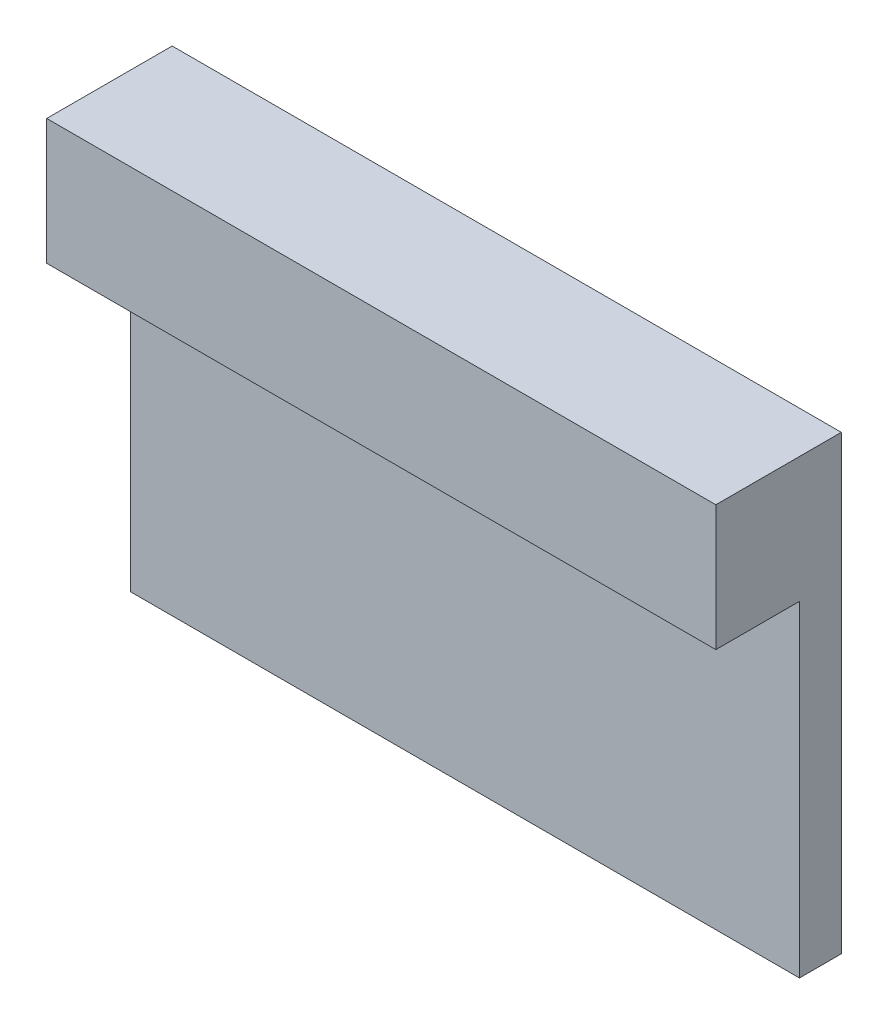
from build123d import *

# Parameters (mm, degrees)
SKETCH2_W           = 160
SKETCH2_H           = 78
BOSS_EXTRUDE1_DEPTH = 10
SKETCH2_3_W         = 160
SKETCH2_3_H         = 30
BOSS_EXTRUDE2_DEPTH = 30


with BuildPart() as part:
    # Sketch2 → Boss-Extrude1 (new body)
    with BuildSketch(Plane.XY):
        with Locations((112.820049602, 21.881187112)):
            Rectangle(SKETCH2_W, SKETCH2_H)
    extrude(amount=BOSS_EXTRUDE1_DEPTH)

    # Sketch2<3> → Boss-Extrude2 (add)
    with BuildSketch(Plane.XY):
        with Locations((112.820049602, 75.881187112)):
            Rectangle(SKETCH2_3_W, SKETCH2_3_H)
    extrude(amount=BOSS_EXTRUDE2_DEPTH)


solid = part.part
